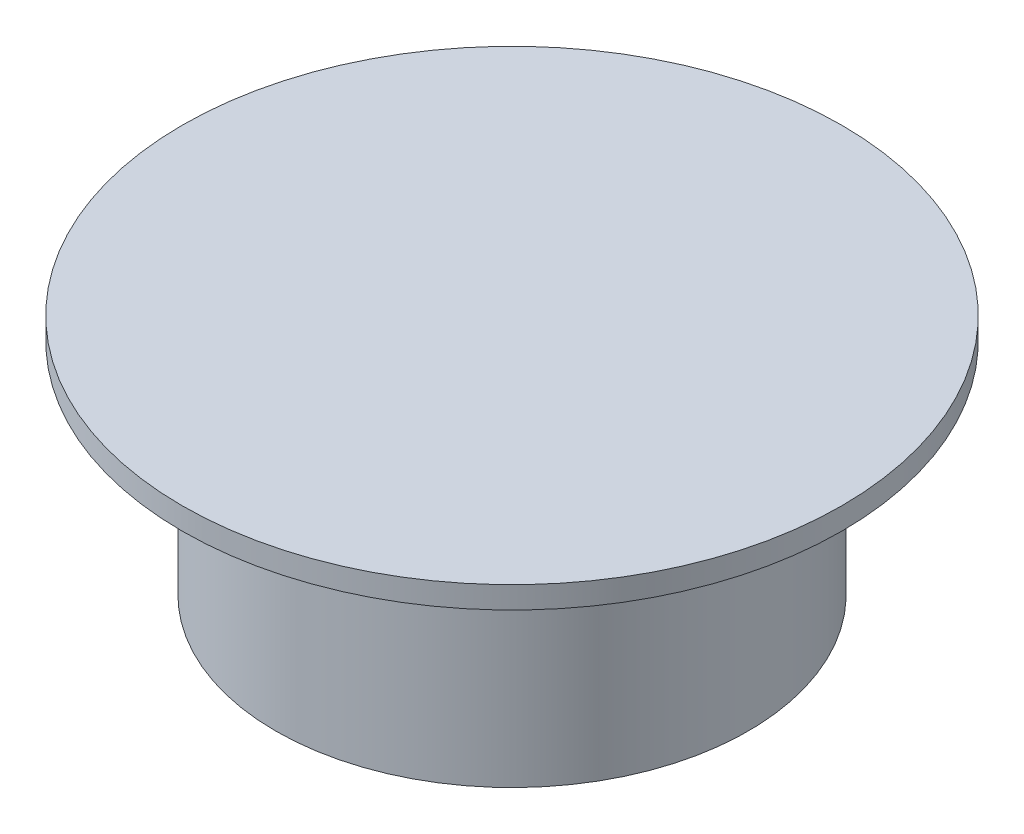
from build123d import *

# Parameters (mm, degrees)
SKETCH2_R           = 10.75
BOSS_EXTRUDE1_DEPTH = 10
SKETCH3_R           = 15
BOSS_EXTRUDE2_DEPTH = 1


with BuildPart() as part:
    # Sketch2 → Boss-Extrude1 (new body)
    with BuildSketch(Plane(origin=(0, 0, 0), x_dir=(1, 0, 0), z_dir=(0, 1, 0))):
        with Locations(Location((0, 0, 0), (0, 0, 270))):
            Circle(SKETCH2_R)
    extrude(amount=BOSS_EXTRUDE1_DEPTH)

    # Sketch3 → Boss-Extrude2 (add)
    with BuildSketch(Plane(origin=(0, 10, 0), x_dir=(1, 0, 0), z_dir=(0, 1, 0))):
        with Locations(Location((0, 0, 0), (0, 0, 270))):
            Circle(SKETCH3_R)
    extrude(amount=BOSS_EXTRUDE2_DEPTH)


solid = part.part
